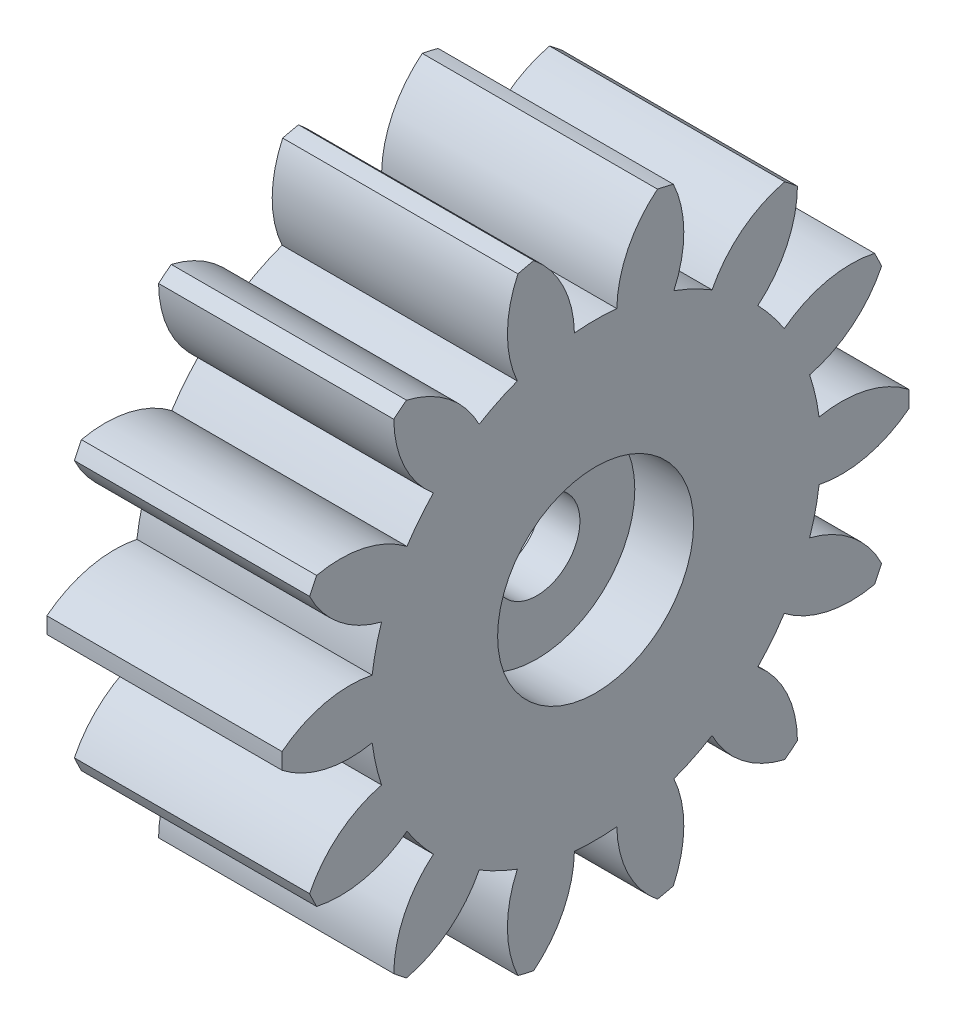
from build123d import *

# Parameters (mm, degrees)
BASPROSKE_W        = 6
BASPROSKE_H        = 8
TOOTHCUT_DEPTH     = 13.806248475
TEETHCUTS_COUNT    = 14
TEETHCUTS_ANGLE    = 334.285714286
BORSKE_R           = 0.4
BORE_DEPTH         = 50.0000508
SKETCH1_R          = 2.5
CUT_EXTRUDE1_DEPTH = 1.5
CUT_EXTRUDE2_START = -3.5
SKETCH2_R          = 2.5
CUT_EXTRUDE2_DEPTH = 3.5
SKETCH3_R          = 1.1
CUT_EXTRUDE3_DEPTH = 2.2


with BuildPart() as part:
    # BasProSke → Base-Revolve (revolve)
    with BuildSketch(Plane(origin=(0, 0, 0), x_dir=(1, 0, 0), z_dir=(0, 1, 0)), mode=Mode.PRIVATE) as base_revolve_sk:
        with Locations((3, 4)):
            Rectangle(BASPROSKE_W, BASPROSKE_H)
    revolve(base_revolve_sk.sketch.rotate(Axis((-10, 0, 0), (1, 0, 0)), 180), axis=Axis((-10, 0, 0), (1, 0, 0)))

    # TooCutSke → ToothCut (cut, through all)
    with BuildSketch(Plane(origin=(0, 0, 0), x_dir=(0, 0, -1), z_dir=(1, 0, 0))):
        with BuildLine():
            ThreePointArc((0.540393256, 5.723545765), (0, 5.749), (-0.540393256, 5.723545765))
            ThreePointArc((-0.540393256, 5.723545765), (-0.832220085, 6.912663993), (-1.603550271, 7.863566092))
            ThreePointArc((-1.603550271, 7.863566092), (0, 8.0254), (1.603550271, 7.863566092))
            ThreePointArc((1.603550271, 7.863566092), (0.832220085, 6.912663993), (0.540393256, 5.723545765))
        make_face()
    toothcut = extrude(amount=TOOTHCUT_DEPTH, mode=Mode.SUBTRACT)

    # TeethCuts: ToothCut ×14 about axis
    teethcuts_axis = Axis((-10, 0, 0), (1, 0, 0))
    for i in range(1, TEETHCUTS_COUNT):
        add(toothcut.rotate(teethcuts_axis, i * TEETHCUTS_ANGLE / (TEETHCUTS_COUNT - 1)), mode=Mode.SUBTRACT)

    # BorSke → Bore (cut, symmetric)
    with BuildSketch(Plane(origin=(0, 0, 0), x_dir=(0, 0, -1), z_dir=(1, 0, 0))):
        with Locations(Location((0, 0, 0), (0, 0, 180))):
            Circle(BORSKE_R)
    extrude(amount=BORE_DEPTH, both=True, mode=Mode.SUBTRACT)

    # Sketch1 → Cut-Extrude1 (cut)
    with BuildSketch(Plane(origin=(6, 0, 0), x_dir=(0, 0, -1), z_dir=(1, 0, 0))):
        Circle(SKETCH1_R)
    extrude(amount=-CUT_EXTRUDE1_DEPTH, mode=Mode.SUBTRACT)

    # Sketch2 → Cut-Extrude2 (cut)
    with BuildSketch(Plane.ZY.offset(CUT_EXTRUDE2_START)):
        with Locations(Location((0, 0, 0), (0, 0, 180))):
            Circle(SKETCH2_R)
    extrude(amount=CUT_EXTRUDE2_DEPTH, mode=Mode.SUBTRACT)

    # Sketch3 → Cut-Extrude3 (cut)
    with BuildSketch(Plane(origin=(4.5, 0, 0), x_dir=(0, 0, -1), z_dir=(1, 0, 0))):
        Circle(SKETCH3_R)
    extrude(amount=-CUT_EXTRUDE3_DEPTH, mode=Mode.SUBTRACT)


solid = part.part
